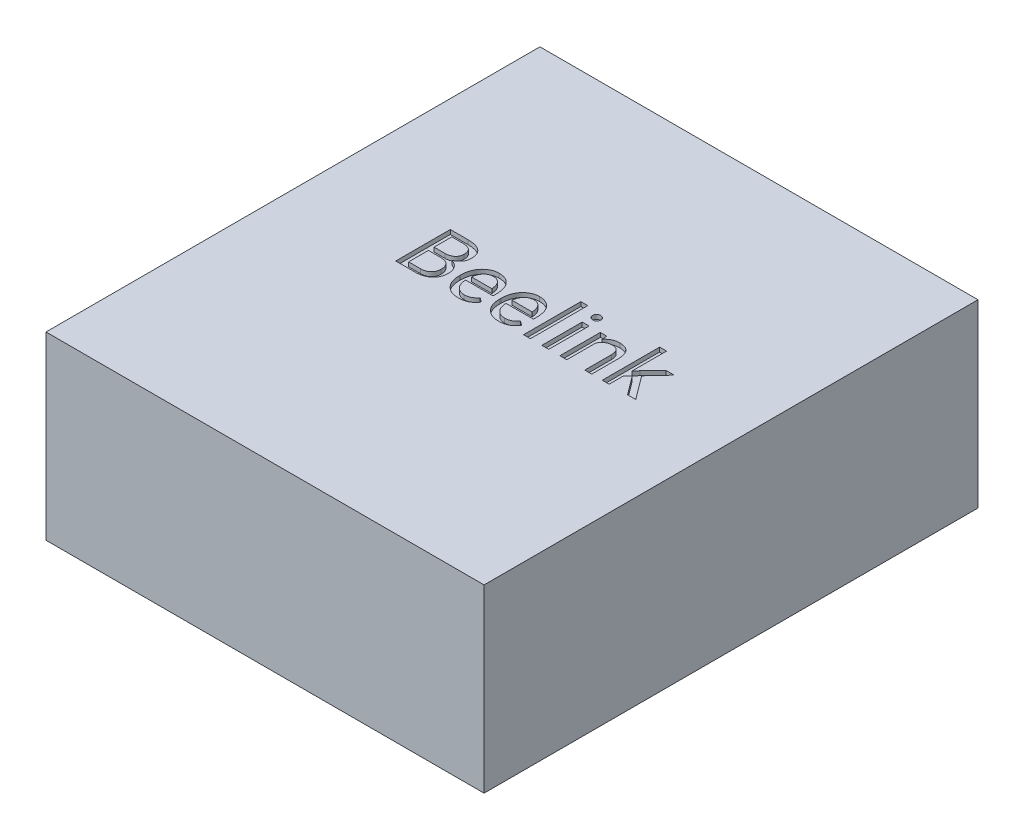
from build123d import *

# Parameters (mm, degrees)
SKETCH1_W           = 101.999999962
SKETCH1_H           = 115.000000124
BOSS_EXTRUDE1_DEPTH = 21.000000037
SKETCH2_W           = 1.608116883
SKETCH2_H           = 13.359740259
SKETCH2_H_2         = 9.401298701
CUT_EXTRUDE1_DEPTH  = 1


with BuildPart() as part:
    # Sketch1 → Boss-Extrude1 (new, symmetric)
    with BuildSketch(Plane(origin=(0, 0, 0), x_dir=(1, 0, 0), z_dir=(0, 1, 0))):
        with Locations((50.999999981, 57.500000062)):
            Rectangle(SKETCH1_W, SKETCH1_H)
    extrude(amount=BOSS_EXTRUDE1_DEPTH, both=True)

    # Sketch2 → Cut-Extrude1 (cut)
    # profile 1 of 8: a face of its own
    with BuildSketch(Plane(origin=(0, 21.000000037, 0), x_dir=(1, 0, 0), z_dir=(0, 1, 0))):
        with BuildLine():
            add(Edge.make_bspline(
                [(60.28742815, 66.98299159), (60.290428507, 67.045103976), (60.296259151, 67.165808024), (60.340841435, 67.339429887), (60.417003673, 67.497174016), (60.523358206, 67.636872258), (60.657963755, 67.75603592), (60.826947028, 67.838905745), (61.022174929, 67.890694573), (61.236609081, 67.901456926), (61.45053152, 67.891397863), (61.645824545, 67.837676465), (61.816015804, 67.757049594), (61.950428067, 67.635890421), (62.061051568, 67.497702153), (62.134705842, 67.336858034), (62.182871536, 67.163775729), (62.196652788, 66.981234821), (62.18244239, 66.798915504), (62.13588572, 66.627674452), (62.059966535, 66.470452117), (61.951250101, 66.334919439), (61.814754031, 66.219488003), (61.645724829, 66.14085911), (61.450106581, 66.090931856), (61.236612712, 66.079523373), (61.022579219, 66.091612661), (60.827090585, 66.139667553), (60.659141977, 66.220451763), (60.522755989, 66.334035188), (60.416407808, 66.471886945), (60.341441498, 66.628446241), (60.295919846, 66.800931065), (60.290326419, 66.920853193), (60.28742815, 66.98299159)],
                knots=[0, 0, 0, 0, 1.003253555, 1.949639571, 2.87501048, 3.816493968, 4.771398848, 5.752595909, 6.830435126, 8.01367739, 9.210771534, 10.275199678, 11.268797055, 12.223701935, 13.173646762, 14.111539333, 15.061484161, 16.064737715, 17.054153962, 18.004098789, 18.916987501, 19.856010126, 20.792977095, 21.780442597, 22.841332467, 24.03842661, 25.221668875, 26.296013986, 27.271001189, 28.207968158, 29.138430125, 30.063801034, 30.996746445, 32, 32, 32, 32], degree=3))
        make_face()
    # profile 2 of 8: a face of its own
    with BuildSketch(Plane(origin=(0, 21.000000037, 0), x_dir=(1, 0, 0), z_dir=(0, 1, 0))):
        with BuildLine():
            Line((26.403580747, 55.032930714), (26.403580747, 67.732930714))
            Line((26.403580747, 67.732930714), (30.544997143, 67.732930714))
            add(Edge.make_bspline(
                [(30.544997143, 67.732930714), (30.711746138, 67.730877717), (31.034625043, 67.726902466), (31.502856082, 67.684422291), (31.93942852, 67.618281622), (32.345329432, 67.527481397), (32.718302944, 67.405242018), (33.060872471, 67.260094344), (33.369441421, 67.083025459), (33.647370945, 66.882302012), (33.891845619, 66.653171586), (34.10445895, 66.398653759), (34.286968685, 66.119495626), (34.430805796, 65.811445513), (34.543946786, 65.480347223), (34.626886885, 65.123988991), (34.676107835, 64.741434185), (34.681210974, 64.47732957), (34.683836429, 64.341453441)],
                knots=[0, 0, 0, 0, 1.309151975, 2.534933147, 3.688414413, 4.775017612, 5.796870019, 6.766812306, 7.691403476, 8.584651898, 9.453285059, 10.315291751, 11.183505686, 12.064622837, 12.977698729, 13.926772462, 14.933369137, 16, 16, 16, 16], degree=3))
            add(Edge.make_bspline(
                [(34.683836429, 64.341453441), (34.678463664, 64.196540139), (34.667914428, 63.912007986), (34.567353887, 63.499184699), (34.411103735, 63.110328018), (34.185780297, 62.754968351), (33.910949773, 62.430327047), (33.586833872, 62.143961277), (33.216463187, 61.895262702), (32.94443399, 61.766074757), (32.805122955, 61.699915292)],
                knots=[0, 0, 0, 0, 1.008886343, 1.980912727, 2.945323687, 3.919322907, 4.901045922, 5.902400094, 6.925781429, 8, 8, 8, 8], degree=3))
            add(Edge.make_bspline(
                [(32.805122955, 61.699915292), (32.888852457, 61.674497367), (33.054114721, 61.624328387), (33.292544983, 61.52878521), (33.515460688, 61.414680028), (33.728123978, 61.288885164), (33.922008666, 61.140289792), (34.107480904, 60.980534908), (34.277169367, 60.802514682), (34.431505478, 60.608792987), (34.570882634, 60.40315553), (34.691348647, 60.186289418), (34.796445943, 59.961459684), (34.877291906, 59.724857683), (34.945963735, 59.48019322), (34.991910248, 59.223924177), (35.016870547, 58.958370336), (35.021613966, 58.778380783), (35.024015, 58.687273246)],
                knots=[0, 0, 0, 0, 1.039369912, 2.051470744, 3.046548053, 4.012784092, 4.982410349, 5.944486565, 6.919042431, 7.899353598, 8.884488038, 9.866922241, 10.844253409, 11.828806071, 12.834090636, 13.861109164, 14.917331194, 16, 16, 16, 16], degree=3))
            add(Edge.make_bspline(
                [(35.024015, 58.687273246), (35.020562417, 58.548795376), (35.013825258, 58.278578226), (34.961041582, 57.885149365), (34.877383748, 57.514133823), (34.755459247, 57.165608422), (34.597166364, 56.840761965), (34.40869572, 56.535686993), (34.182392034, 56.255602644), (33.921043111, 56.000995963), (33.630949434, 55.771254101), (33.309332421, 55.574062647), (32.960624209, 55.406107721), (32.58177779, 55.27077581), (32.176291726, 55.160975758), (31.741068306, 55.089305458), (31.27884871, 55.040886566), (30.960904908, 55.035630922), (30.797553962, 55.032930714)],
                knots=[0, 0, 0, 0, 1.049075654, 2.047101349, 3.002475573, 3.926896879, 4.838205817, 5.735951355, 6.638757173, 7.559434705, 8.495812441, 9.437042784, 10.412434373, 11.423558549, 12.481544009, 13.591372826, 14.762512353, 16, 16, 16, 16], degree=3))
            Line((30.797553962, 55.032930714), (26.403580747, 55.032930714))
        make_face()
        with BuildLine():
            Line((28.07354828, 60.970593051), (28.07354828, 56.352411233))
            Line((28.07354828, 56.352411233), (30.831056397, 56.352411233))
            add(Edge.make_bspline(
                [(30.831056397, 56.352411233), (30.925623018, 56.354501862), (31.110891828, 56.358597687), (31.380541883, 56.387237701), (31.635142369, 56.432790709), (31.873755561, 56.499298864), (32.095704962, 56.589090251), (32.306006788, 56.689834992), (32.498327056, 56.815424702), (32.673074777, 56.959655579), (32.830954043, 57.120391869), (32.971642378, 57.295099221), (33.086788386, 57.487732975), (33.184430433, 57.6923858), (33.254291063, 57.913287913), (33.310361392, 58.146271652), (33.340531729, 58.39526865), (33.344353839, 58.566076741), (33.346316137, 58.653770811)],
                knots=[0, 0, 0, 0, 1.17537015, 2.302709183, 3.366670673, 4.387535222, 5.375016501, 6.339659715, 7.281516397, 8.222161688, 9.150913108, 10.078128639, 11.002943091, 11.934452729, 12.8900704, 13.876916401, 14.909994011, 16, 16, 16, 16], degree=3))
            add(Edge.make_bspline(
                [(33.346316137, 58.653770811), (33.344207474, 58.7474709), (33.34011546, 58.929302726), (33.312288889, 59.193289293), (33.263475083, 59.438157478), (33.196434067, 59.665522294), (33.109259197, 59.875235316), (33.00011473, 60.066661995), (32.874065695, 60.240531289), (32.726869896, 60.395815009), (32.559180871, 60.530309439), (32.374636275, 60.652770209), (32.166867641, 60.746922534), (31.943508324, 60.833163616), (31.697802466, 60.891269723), (31.434879415, 60.939583933), (31.151909567, 60.963614776), (30.957366874, 60.968215437), (30.8568275, 60.970593051)],
                knots=[0, 0, 0, 0, 1.153059794, 2.237596239, 3.261769359, 4.221674744, 5.150336046, 6.04983856, 6.927329638, 7.787260757, 8.673874136, 9.568205799, 10.504477487, 11.474516372, 12.510353165, 13.605298609, 14.762421892, 16, 16, 16, 16], degree=3))
            Line((30.8568275, 60.970593051), (28.07354828, 60.970593051))
        make_face(mode=Mode.SUBTRACT)
        with BuildLine():
            Line((28.07354828, 62.290073571), (30.596539351, 62.290073571))
            add(Edge.make_bspline(
                [(30.596539351, 62.290073571), (30.685971717, 62.290984845), (30.860170839, 62.292759852), (31.114089827, 62.323168954), (31.354258512, 62.366726099), (31.582323447, 62.423844513), (31.794232858, 62.505878825), (31.994303099, 62.600684164), (32.180552913, 62.714018898), (32.35077301, 62.846352794), (32.505421485, 62.992264914), (32.639951026, 63.151957503), (32.752536638, 63.325452485), (32.844800703, 63.510512806), (32.918342996, 63.709058233), (32.968586318, 63.920218833), (33.000671884, 64.143753832), (33.004286856, 64.296669616), (33.006137565, 64.374955876)],
                knots=[0, 0, 0, 0, 1.19306753, 2.323893774, 3.407998528, 4.450994391, 5.45624191, 6.435851444, 7.403440774, 8.359890343, 9.308886944, 10.236795991, 11.140075102, 12.063153476, 12.991912387, 13.959773474, 14.955492365, 16, 16, 16, 16], degree=3))
            add(Edge.make_bspline(
                [(33.006137565, 64.374955876), (33.004123142, 64.460948044), (33.000223753, 64.627406051), (32.971325521, 64.867913575), (32.926353893, 65.091149535), (32.859337534, 65.29514021), (32.77336706, 65.481404868), (32.668412994, 65.649300323), (32.541954443, 65.797637396), (32.399977023, 65.931500991), (32.234506311, 66.043399199), (32.053566163, 66.147067473), (31.848250084, 66.226114121), (31.626976152, 66.297700363), (31.383888521, 66.347354876), (31.122442111, 66.386076031), (30.840061338, 66.409367323), (30.64554766, 66.412058854), (30.544997143, 66.413450194)],
                knots=[0, 0, 0, 0, 1.122592733, 2.173041476, 3.158602951, 4.09150051, 4.969724519, 5.831753348, 6.66762367, 7.508970248, 8.370926094, 9.269753703, 10.225830719, 11.236913591, 12.303940478, 13.460375598, 14.687184639, 16, 16, 16, 16], degree=3))
            Line((30.544997143, 66.413450194), (28.07354828, 66.413450194))
            Line((28.07354828, 66.413450194), (28.07354828, 62.290073571))
        make_face(mode=Mode.SUBTRACT)
    # profile 3 of 8: a face of its own
    with BuildSketch(Plane(origin=(0, 21.000000037, 0), x_dir=(1, 0, 0), z_dir=(0, 1, 0))):
        with BuildLine():
            add(Edge.make_bspline(
                [(41.090532858, 54.867995649), (40.934887239, 54.872280736), (40.629423561, 54.880690471), (40.182061248, 54.937130543), (39.756105703, 55.034911795), (39.353519038, 55.175173399), (38.971944961, 55.350546413), (38.613268903, 55.56549008), (38.279884257, 55.823613263), (37.968606179, 56.115815172), (37.688280769, 56.442160134), (37.444911925, 56.797925961), (37.237180425, 57.179385856), (37.067593881, 57.587122036), (36.934879098, 58.021187479), (36.844136106, 58.482352387), (36.785547879, 58.969243092), (36.779523246, 59.303027612), (36.776450065, 59.473291915)],
                knots=[0, 0, 0, 0, 1.051225119, 2.063091096, 3.039863284, 3.997702364, 4.937463199, 5.871835042, 6.815332018, 7.779913259, 8.750981872, 9.715004522, 10.6860558, 11.679572897, 12.692718992, 13.746423136, 14.850444908, 16, 16, 16, 16], degree=3))
            Line((36.776450065, 59.473291915), (36.776450065, 59.767082499))
            add(Edge.make_bspline(
                [(36.776450065, 59.767082499), (36.77764053, 59.88225049), (36.779989046, 60.109450624), (36.807432089, 60.444799099), (36.847479484, 60.771081749), (36.907252065, 61.087523354), (36.982333769, 61.395404614), (37.071596527, 61.694620266), (37.180048413, 61.983943582), (37.306855436, 62.262333779), (37.447467238, 62.528033667), (37.600228099, 62.781095019), (37.768586748, 63.017750954), (37.947643184, 63.242132275), (38.142130177, 63.450131221), (38.352117755, 63.639355742), (38.571018804, 63.819632825), (38.804693426, 63.980045538), (39.046731345, 64.124436129), (39.294723555, 64.250843318), (39.547946211, 64.360623196), (39.806953542, 64.447032827), (40.070507506, 64.514890698), (40.33821093, 64.564155275), (40.612292132, 64.592616916), (40.796678643, 64.596971781), (40.889518247, 64.59916448)],
                knots=[0, 0, 0, 0, 1.170389505, 2.308911091, 3.417986088, 4.510645856, 5.58017196, 6.638193788, 7.682688568, 8.718275774, 9.745583472, 10.73697058, 11.720597728, 12.695660602, 13.65320595, 14.611228956, 15.567220266, 16.533682422, 17.489115256, 18.430275997, 19.361295633, 20.291864719, 21.202556407, 22.125721625, 23.056290712, 24, 24, 24, 24], degree=3))
            add(Edge.make_bspline(
                [(40.889518247, 64.59916448), (41.038335194, 64.596148514), (41.328522637, 64.590267495), (41.750403001, 64.531541051), (42.148142352, 64.439998545), (42.519929294, 64.308567711), (42.866919608, 64.139496732), (43.187372114, 63.933123077), (43.481744164, 63.687505157), (43.749165671, 63.40611265), (43.990637091, 63.09108464), (44.196036276, 62.740228427), (44.372412594, 62.360013544), (44.513512996, 61.946773877), (44.624035787, 61.501806626), (44.702273708, 61.024349643), (44.752923293, 60.514675984), (44.757817794, 60.164084823), (44.760338052, 59.983559772)],
                knots=[0, 0, 0, 0, 1.043722712, 2.035219983, 2.982713475, 3.903600427, 4.795969756, 5.68552487, 6.571580403, 7.479752251, 8.404498235, 9.350456392, 10.326811463, 11.341010182, 12.409761646, 13.540517269, 14.733572618, 16, 16, 16, 16], degree=3))
            Line((44.760338052, 59.983559772), (44.760338052, 59.321242402))
            Line((44.760338052, 59.321242402), (38.384566949, 59.321242402))
            add(Edge.make_bspline(
                [(38.384566949, 59.321242402), (38.389648224, 59.206847123), (38.399578192, 58.983292712), (38.444386598, 58.656737585), (38.510953044, 58.346366547), (38.600780137, 58.052057193), (38.714218454, 57.774838273), (38.852074125, 57.515419025), (39.011639763, 57.272170196), (39.195045326, 57.048768818), (39.394240309, 56.845806053), (39.609354035, 56.668097655), (39.840041985, 56.522050431), (40.081942237, 56.398754291), (40.336968217, 56.303467912), (40.605889093, 56.236746392), (40.887273804, 56.193843701), (41.080064946, 56.189623402), (41.178154611, 56.187476168)],
                knots=[0, 0, 0, 0, 1.170963297, 2.288328803, 3.36740092, 4.415427927, 5.432183575, 6.42682151, 7.416438249, 8.403319616, 9.37898494, 10.321963152, 11.250788358, 12.166549739, 13.095374945, 14.028969237, 14.997164786, 16, 16, 16, 16], degree=3))
            add(Edge.make_bspline(
                [(41.178154611, 56.187476168), (41.31501129, 56.190934421), (41.579203048, 56.197610323), (41.958907531, 56.26280541), (42.305817384, 56.37108407), (42.6212108, 56.522799635), (42.909514498, 56.712588546), (43.179208758, 56.928626083), (43.43233964, 57.171970515), (43.581749943, 57.353348906), (43.657334806, 57.445106038)],
                knots=[0, 0, 0, 0, 1.136012797, 2.192989183, 3.18823502, 4.145723679, 5.089823975, 6.04933131, 7.013180329, 8, 8, 8, 8], degree=3))
            Line((43.657334806, 57.445106038), (44.639213864, 56.682281363))
            add(Edge.make_bspline(
                [(44.639213864, 56.682281363), (44.537999363, 56.537708548), (44.339447152, 56.25410045), (43.984120335, 55.882572624), (43.592462903, 55.567923416), (43.163185239, 55.310640625), (42.696874445, 55.110404187), (42.193355151, 54.970033114), (41.653638133, 54.883053663), (41.281578353, 54.873104402), (41.090532858, 54.867995649)],
                knots=[0, 0, 0, 0, 1.014704253, 1.990542579, 2.947365425, 3.898858026, 4.862403721, 5.859509066, 6.90089934, 8, 8, 8, 8], degree=3))
        make_face()
        with BuildLine():
            add(Edge.make_bspline(
                [(40.889518247, 63.27968396), (40.809493372, 63.278061736), (40.652994938, 63.274889279), (40.42351053, 63.239369355), (40.203586548, 63.185188686), (39.991596256, 63.11198461), (39.791782431, 63.011251024), (39.599562765, 62.893407123), (39.419472642, 62.750084121), (39.248573857, 62.587877981), (39.092819852, 62.404749108), (38.949064493, 62.206067958), (38.826557589, 61.986760711), (38.714033997, 61.752864006), (38.623230653, 61.498022574), (38.54231232, 61.228482913), (38.480656135, 60.940486363), (38.452906547, 60.742289126), (38.438686267, 60.640722921)],
                knots=[0, 0, 0, 0, 0.965700087, 1.888544676, 2.796872033, 3.699195918, 4.589995704, 5.493928382, 6.417472449, 7.364036721, 8.335127011, 9.316799301, 10.320480783, 11.364630344, 12.447737028, 13.5835194, 14.761674146, 16, 16, 16, 16], degree=3))
            Line((38.438686267, 60.640722921), (43.152221169, 60.640722921))
            Line((43.152221169, 60.640722921), (43.152221169, 60.759269999))
            add(Edge.make_bspline(
                [(43.152221169, 60.759269999), (43.144773744, 60.856451103), (43.130223685, 61.046314151), (43.0897902, 61.322238203), (43.029641913, 61.581154734), (42.956355855, 61.822964586), (42.864852266, 62.048075), (42.757316726, 62.256179009), (42.633304131, 62.448048844), (42.493523319, 62.621798409), (42.338985136, 62.776622574), (42.17052819, 62.911627146), (41.988949508, 63.025761363), (41.79437062, 63.11897957), (41.58688203, 63.191324298), (41.365771146, 63.242782293), (41.131800862, 63.273962254), (40.971223302, 63.277754427), (40.889518247, 63.27968396)],
                knots=[0, 0, 0, 0, 1.231488959, 2.405964106, 3.519878164, 4.587773015, 5.59571827, 6.586208607, 7.543728754, 8.477887434, 9.399024737, 10.302660484, 11.200211513, 12.103325454, 13.023438702, 13.971372583, 14.967794054, 16, 16, 16, 16], degree=3))
        make_face(mode=Mode.SUBTRACT)
    # profile 4 of 8: a face of its own
    with BuildSketch(Plane(origin=(0, 21.000000037, 0), x_dir=(1, 0, 0), z_dir=(0, 1, 0))):
        with BuildLine():
            add(Edge.make_bspline(
                [(50.491831559, 54.867995649), (50.33618594, 54.872280736), (50.030722262, 54.880690471), (49.583359949, 54.937130543), (49.157404404, 55.034911795), (48.754817739, 55.175173399), (48.373243662, 55.350546413), (48.014567605, 55.56549008), (47.681182958, 55.823613263), (47.369904881, 56.115815172), (47.089579471, 56.442160134), (46.846210626, 56.797925961), (46.638479127, 57.179385856), (46.468892582, 57.587122036), (46.3361778, 58.021187479), (46.245434807, 58.482352387), (46.18684658, 58.969243092), (46.180821947, 59.303027612), (46.177748767, 59.473291915)],
                knots=[0, 0, 0, 0, 1.051225119, 2.063091096, 3.039863284, 3.997702364, 4.937463199, 5.871835042, 6.815332018, 7.779913259, 8.750981872, 9.715004522, 10.6860558, 11.679572897, 12.692718992, 13.746423136, 14.850444908, 16, 16, 16, 16], degree=3))
            Line((46.177748767, 59.473291915), (46.177748767, 59.767082499))
            add(Edge.make_bspline(
                [(46.177748767, 59.767082499), (46.178939232, 59.88225049), (46.181287747, 60.109450624), (46.20873079, 60.444799099), (46.248778185, 60.771081749), (46.308550767, 61.087523354), (46.383632471, 61.395404614), (46.472895228, 61.694620266), (46.581347114, 61.983943582), (46.708154137, 62.262333779), (46.848765939, 62.528033667), (47.0015268, 62.781095019), (47.16988545, 63.017750954), (47.348941886, 63.242132275), (47.543428878, 63.450131221), (47.753416456, 63.639355742), (47.972317505, 63.819632825), (48.205992127, 63.980045538), (48.448030046, 64.124436129), (48.696022256, 64.250843318), (48.949244913, 64.360623196), (49.208252244, 64.447032827), (49.471806208, 64.514890698), (49.739509632, 64.564155275), (50.013590833, 64.592616916), (50.197977344, 64.596971781), (50.290816949, 64.59916448)],
                knots=[0, 0, 0, 0, 1.170389505, 2.308911091, 3.417986088, 4.510645856, 5.58017196, 6.638193788, 7.682688568, 8.718275774, 9.745583472, 10.73697058, 11.720597728, 12.695660602, 13.65320595, 14.611228956, 15.567220266, 16.533682422, 17.489115256, 18.430275997, 19.361295633, 20.291864719, 21.202556407, 22.125721625, 23.056290712, 24, 24, 24, 24], degree=3))
            add(Edge.make_bspline(
                [(50.290816949, 64.59916448), (50.439633896, 64.596148514), (50.729821338, 64.590267495), (51.151701703, 64.531541051), (51.549441054, 64.439998545), (51.921227996, 64.308567711), (52.268218309, 64.139496732), (52.588670816, 63.933123077), (52.883042866, 63.687505157), (53.150464373, 63.40611265), (53.391935792, 63.09108464), (53.597334977, 62.740228427), (53.773711296, 62.360013544), (53.914811697, 61.946773877), (54.025334489, 61.501806626), (54.103572409, 61.024349643), (54.154221994, 60.514675984), (54.159116496, 60.164084823), (54.161636754, 59.983559772)],
                knots=[0, 0, 0, 0, 1.043722712, 2.035219983, 2.982713475, 3.903600427, 4.795969756, 5.68552487, 6.571580403, 7.479752251, 8.404498235, 9.350456392, 10.326811463, 11.341010182, 12.409761646, 13.540517269, 14.733572618, 16, 16, 16, 16], degree=3))
            Line((54.161636754, 59.983559772), (54.161636754, 59.321242402))
            Line((54.161636754, 59.321242402), (47.78586565, 59.321242402))
            add(Edge.make_bspline(
                [(47.78586565, 59.321242402), (47.790946925, 59.206847123), (47.800876893, 58.983292712), (47.845685299, 58.656737585), (47.912251745, 58.346366547), (48.002078838, 58.052057193), (48.115517155, 57.774838273), (48.253372827, 57.515419025), (48.412938464, 57.272170196), (48.596344028, 57.048768818), (48.79553901, 56.845806053), (49.010652736, 56.668097655), (49.241340687, 56.522050431), (49.483240939, 56.398754291), (49.738266918, 56.303467912), (50.007187795, 56.236746392), (50.288572505, 56.193843701), (50.481363648, 56.189623402), (50.579453312, 56.187476168)],
                knots=[0, 0, 0, 0, 1.170963297, 2.288328803, 3.36740092, 4.415427927, 5.432183575, 6.42682151, 7.416438249, 8.403319616, 9.37898494, 10.321963152, 11.250788358, 12.166549739, 13.095374945, 14.028969237, 14.997164786, 16, 16, 16, 16], degree=3))
            add(Edge.make_bspline(
                [(50.579453312, 56.187476168), (50.716309991, 56.190934421), (50.980501749, 56.197610323), (51.360206232, 56.26280541), (51.707116086, 56.37108407), (52.022509502, 56.522799635), (52.310813199, 56.712588546), (52.580507459, 56.928626083), (52.833638342, 57.171970515), (52.983048644, 57.353348906), (53.058633507, 57.445106038)],
                knots=[0, 0, 0, 0, 1.136012797, 2.192989183, 3.18823502, 4.145723679, 5.089823975, 6.04933131, 7.013180329, 8, 8, 8, 8], degree=3))
            Line((53.058633507, 57.445106038), (54.040512565, 56.682281363))
            add(Edge.make_bspline(
                [(54.040512565, 56.682281363), (53.939298065, 56.537708548), (53.740745854, 56.25410045), (53.385419036, 55.882572624), (52.993761604, 55.567923416), (52.56448394, 55.310640625), (52.098173146, 55.110404187), (51.594653853, 54.970033114), (51.054936834, 54.883053663), (50.682877054, 54.873104402), (50.491831559, 54.867995649)],
                knots=[0, 0, 0, 0, 1.014704253, 1.990542579, 2.947365425, 3.898858026, 4.862403721, 5.859509066, 6.90089934, 8, 8, 8, 8], degree=3))
        make_face()
        with BuildLine():
            add(Edge.make_bspline(
                [(50.290816949, 63.27968396), (50.210792073, 63.278061736), (50.054293639, 63.274889279), (49.824809231, 63.239369355), (49.604885249, 63.185188686), (49.392894957, 63.11198461), (49.193081132, 63.011251024), (49.000861467, 62.893407123), (48.820771344, 62.750084121), (48.649872558, 62.587877981), (48.494118554, 62.404749108), (48.350363195, 62.206067958), (48.22785629, 61.986760711), (48.115332698, 61.752864006), (48.024529355, 61.498022574), (47.943611021, 61.228482913), (47.881954836, 60.940486363), (47.854205248, 60.742289126), (47.839984968, 60.640722921)],
                knots=[0, 0, 0, 0, 0.965700087, 1.888544676, 2.796872033, 3.699195918, 4.589995704, 5.493928382, 6.417472449, 7.364036721, 8.335127011, 9.316799301, 10.320480783, 11.364630344, 12.447737028, 13.5835194, 14.761674146, 16, 16, 16, 16], degree=3))
            Line((47.839984968, 60.640722921), (52.553519871, 60.640722921))
            Line((52.553519871, 60.640722921), (52.553519871, 60.759269999))
            add(Edge.make_bspline(
                [(52.553519871, 60.759269999), (52.546072446, 60.856451103), (52.531522386, 61.046314151), (52.491088901, 61.322238203), (52.430940614, 61.581154734), (52.357654556, 61.822964586), (52.266150968, 62.048075), (52.158615428, 62.256179009), (52.034602832, 62.448048844), (51.894822021, 62.621798409), (51.740283838, 62.776622574), (51.571826892, 62.911627146), (51.390248209, 63.025761363), (51.195669321, 63.11897957), (50.988180731, 63.191324298), (50.767069848, 63.242782293), (50.533099564, 63.273962254), (50.372522003, 63.277754427), (50.290816949, 63.27968396)],
                knots=[0, 0, 0, 0, 1.231488959, 2.405964106, 3.519878164, 4.587773015, 5.59571827, 6.586208607, 7.543728754, 8.477887434, 9.399024737, 10.302660484, 11.200211513, 12.103325454, 13.023438702, 13.971372583, 14.967794054, 16, 16, 16, 16], degree=3))
        make_face(mode=Mode.SUBTRACT)
    # profile 5 of 8: a face of its own
    with BuildSketch(Plane(origin=(0, 21.000000037, 0), x_dir=(1, 0, 0), z_dir=(0, 1, 0))):
        with Locations((56.950070196, 61.712800844)):
            Rectangle(SKETCH2_W, SKETCH2_H)
    # profile 6 of 8: a face of its own
    with BuildSketch(Plane(origin=(0, 21.000000037, 0), x_dir=(1, 0, 0), z_dir=(0, 1, 0))):
        with Locations((61.222919222, 59.733580065)):
            Rectangle(SKETCH2_W, SKETCH2_H_2)
    # profile 7 of 8: a face of its own
    with BuildSketch(Plane(origin=(0, 21.000000037, 0), x_dir=(1, 0, 0), z_dir=(0, 1, 0))):
        with BuildLine():
            Line((66.140045845, 64.434229415), (66.191588052, 63.246181525))
            add(Edge.make_bspline(
                [(66.191588052, 63.246181525), (66.282946627, 63.35397664), (66.462441009, 63.565764285), (66.765979069, 63.841615892), (67.088457758, 64.077126664), (67.432699261, 64.268961365), (67.79930826, 64.416469258), (68.185056315, 64.521354079), (68.591093293, 64.58884456), (68.868931438, 64.595673769), (69.010946819, 64.59916448)],
                knots=[0, 0, 0, 0, 1.045030138, 2.05319576, 3.027464063, 3.995257506, 4.962319553, 5.944976367, 6.949586405, 8, 8, 8, 8], degree=3))
            add(Edge.make_bspline(
                [(69.010946819, 64.59916448), (69.131298204, 64.596715655), (69.365781296, 64.591944559), (69.705998091, 64.554357439), (70.022001068, 64.4860855), (70.31660277, 64.397112303), (70.587424995, 64.278701445), (70.835939459, 64.132703351), (71.059926739, 63.960132286), (71.261478045, 63.76101999), (71.439165265, 63.537052419), (71.592230714, 63.28535497), (71.724345142, 63.0096363), (71.828739997, 62.704567804), (71.913312993, 62.375457031), (71.975671835, 62.019724108), (72.010176799, 61.637872192), (72.017326662, 61.374405311), (72.021011754, 61.238612532)],
                knots=[0, 0, 0, 0, 1.11894567, 2.180064983, 3.176408189, 4.121284808, 5.036911353, 5.917734688, 6.794819938, 7.658971414, 8.545893982, 9.445919302, 10.392684596, 11.382926046, 12.438741236, 13.549675942, 14.737084854, 16, 16, 16, 16], degree=3))
            Line((72.021011754, 61.238612532), (72.021011754, 55.032930714))
            Line((72.021011754, 55.032930714), (70.41031776, 55.032930714))
            Line((70.41031776, 55.032930714), (70.41031776, 61.282423408))
            add(Edge.make_bspline(
                [(70.41031776, 61.282423408), (70.408910106, 61.364938639), (70.406191423, 61.52430499), (70.383199557, 61.755356474), (70.343251681, 61.968275116), (70.297154305, 62.167313866), (70.22765563, 62.346870349), (70.152398029, 62.513631957), (70.059144826, 62.662312122), (69.948265256, 62.791397407), (69.827964645, 62.910483077), (69.685698416, 63.00741108), (69.531474734, 63.092445782), (69.361160475, 63.16448712), (69.173101082, 63.212639133), (68.97109742, 63.252521033), (68.752905162, 63.275607317), (68.602098184, 63.278291596), (68.523872955, 63.27968396)],
                knots=[0, 0, 0, 0, 1.252582418, 2.419183561, 3.51915157, 4.540799327, 5.51463237, 6.436427351, 7.315632186, 8.167224478, 9.015815731, 9.87694107, 10.769965296, 11.68787746, 12.674980604, 13.710846149, 14.812590855, 16, 16, 16, 16], degree=3))
            add(Edge.make_bspline(
                [(68.523872955, 63.27968396), (68.3971307, 63.275225689), (68.148722005, 63.266487692), (67.788902814, 63.183059135), (67.452111002, 63.051197767), (67.143223254, 62.866981795), (66.86437395, 62.640859416), (66.615315836, 62.381690135), (66.398010925, 62.088577404), (66.284969738, 61.871702717), (66.227667598, 61.761765941)],
                knots=[0, 0, 0, 0, 1.044429403, 2.047031152, 3.030327181, 4.018694736, 5.001760782, 5.984392266, 6.978260582, 8, 8, 8, 8], degree=3))
            Line((66.227667598, 61.761765941), (66.227667598, 55.032930714))
            Line((66.227667598, 55.032930714), (64.619550715, 55.032930714))
            Line((64.619550715, 55.032930714), (64.619550715, 64.434229415))
            Line((64.619550715, 64.434229415), (66.140045845, 64.434229415))
        make_face()
    # profile 8 of 8: a face of its own
    with BuildSketch(Plane(origin=(0, 21.000000037, 0), x_dir=(1, 0, 0), z_dir=(0, 1, 0))):
        Polygon((77.105650552, 59.385670162), (76.09542328, 58.334209123), (76.09542328, 55.032930714), (74.487306397, 55.032930714), (74.487306397, 68.392670973), (76.09542328, 68.392670973), (76.09542328, 60.308275681), (76.95617815, 61.341696947), (79.888929773, 64.434229415), (81.844956559, 64.434229415), (78.182882695, 60.506713181), (82.272756884, 55.032930714), (80.383734968, 55.032930714), align=None)
    extrude(amount=-CUT_EXTRUDE1_DEPTH, mode=Mode.SUBTRACT)


solid = part.part
